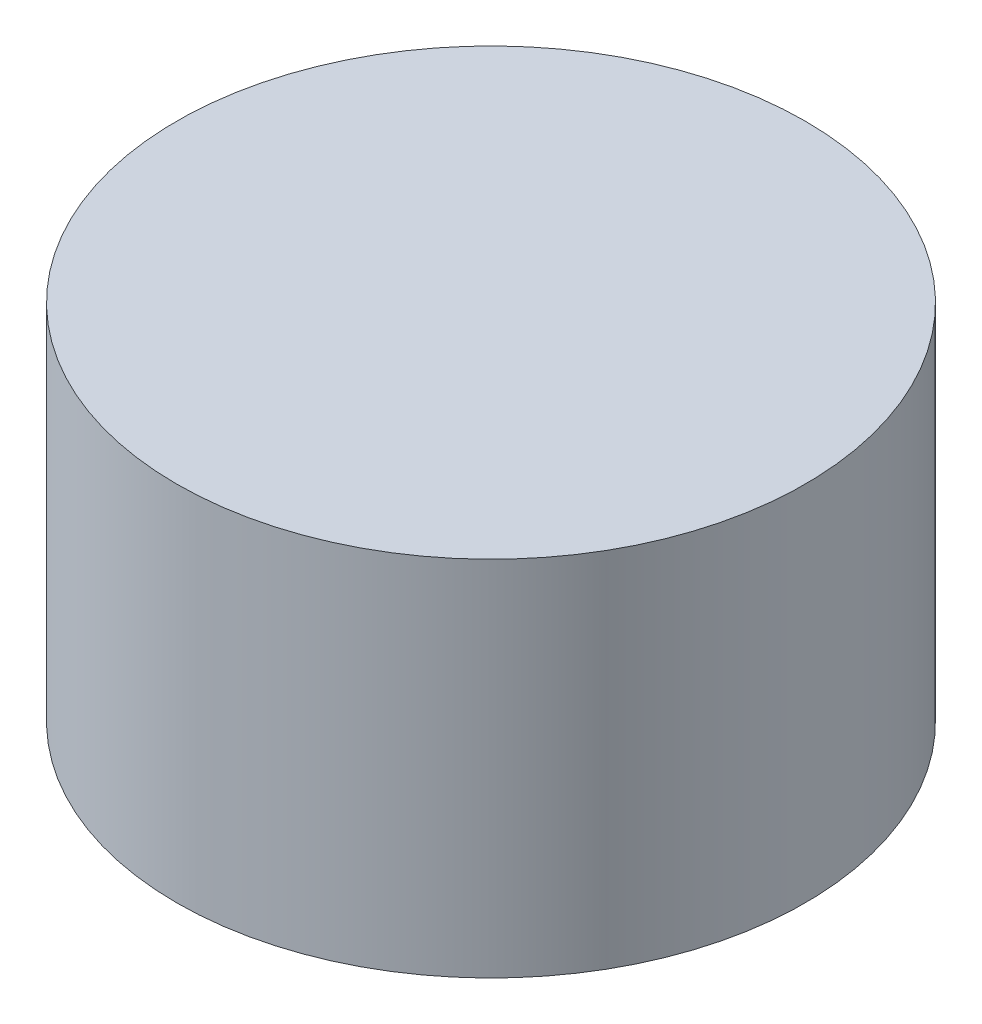
from build123d import *

# Parameters (mm, degrees)
BOSS_EXTRUDE1_START = 240
SKETCH1_R           = 260
BOSS_EXTRUDE1_DEPTH = 300


with BuildPart() as part:
    # Sketch1 → Boss-Extrude1 (new body)
    with BuildSketch(Plane(origin=(0, 0, 0), x_dir=(1, 0, 0), z_dir=(0, 1, 0)).offset(BOSS_EXTRUDE1_START)):
        with Locations(Location((0, 0, 0), (0, 0, 270))):
            Circle(SKETCH1_R)
    extrude(amount=BOSS_EXTRUDE1_DEPTH)


solid = part.part
